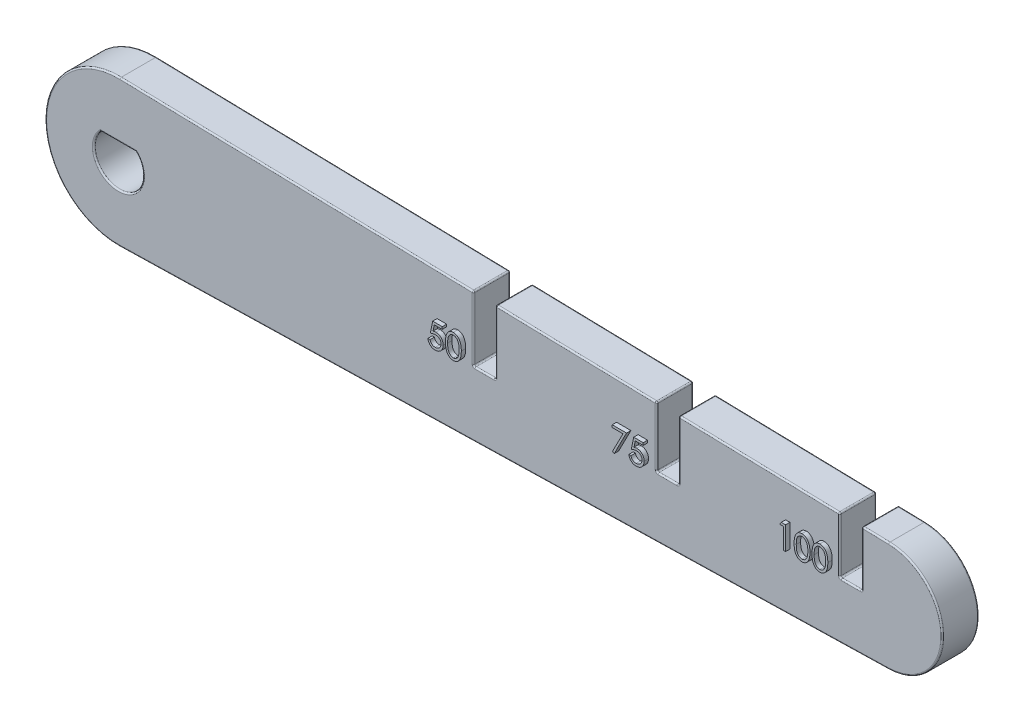
from build123d import *

# Parameters (mm, degrees)
BOSS_EXTRUDE1_DEPTH = 5
CUT_EXTRUDE2_REACH  = 115.054
CUT_EXTRUDE3_REACH  = 115.054
SKETCH4_W           = 3
SKETCH4_H           = 7.656932545
SKETCH4_H_2         = 8.25233943
SKETCH4_H_3         = 8.847746315
FILLET1_R           = 0.2
BOSS_EXTRUDE2_DEPTH = 0.6


with BuildPart() as part:
    # Sketch3 → Boss-Extrude1 (new body)
    with BuildSketch(Plane.XY):
        with BuildLine():
            Line((0.238095238, 9.997165131), (105.178571429, 7.497873848))
            ThreePointArc((105.178571429, 7.497873848), (112.5, 0), (105.178571429, -7.497873848))
            Line((105.178571429, -7.497873848), (0.238095238, -9.997165131))
            ThreePointArc((0.238095238, -9.997165131), (-10, 0), (0.238095238, 9.997165131))
        make_face()
    extrude(amount=BOSS_EXTRUDE1_DEPTH)

    # Sketch2 → Cut-Extrude2 (cut, up to next)
    with BuildSketch(Plane.XY, mode=Mode.PRIVATE) as cut_extrude2_sk1:
        with BuildLine():
            Line((-2.4, 2.337199179), (2.4, 2.337199179))
            ThreePointArc((2.4, 2.337199179), (0, -3.35), (-2.4, 2.337199179))
        make_face()
    cut_extrude2_tool1 = extrude(cut_extrude2_sk1.sketch, amount=CUT_EXTRUDE2_REACH, mode=Mode.PRIVATE) & part.part
    add(cut_extrude2_tool1.solids().sort_by_distance((0, -0.288877, 0))[0], mode=Mode.SUBTRACT)

    # Sketch4 → Cut-Extrude3 (cut, up to next)
    with BuildSketch(Plane.XY.offset(5), mode=Mode.PRIVATE) as cut_extrude3_sk1:
        with Locations((100, 3.828466273)):
            Rectangle(SKETCH4_W, SKETCH4_H)
    cut_extrude3_tool1 = extrude(cut_extrude3_sk1.sketch, amount=-CUT_EXTRUDE3_REACH, mode=Mode.PRIVATE) & part.part
    # Sketch4 → Cut-Extrude3 (cut, up to next)
    with BuildSketch(Plane.XY.offset(5), mode=Mode.PRIVATE) as cut_extrude3_sk2:
        with Locations((75, 4.126169715)):
            Rectangle(SKETCH4_W, SKETCH4_H_2)
    cut_extrude3_tool2 = extrude(cut_extrude3_sk2.sketch, amount=-CUT_EXTRUDE3_REACH, mode=Mode.PRIVATE) & part.part
    # Sketch4 → Cut-Extrude3 (cut, up to next)
    with BuildSketch(Plane.XY.offset(5), mode=Mode.PRIVATE) as cut_extrude3_sk3:
        with Locations((50, 4.423873158)):
            Rectangle(SKETCH4_W, SKETCH4_H_3)
    cut_extrude3_tool3 = extrude(cut_extrude3_sk3.sketch, amount=-CUT_EXTRUDE3_REACH, mode=Mode.PRIVATE) & part.part
    add(cut_extrude3_tool1.solids().sort_by_distance((100, 3.828466, 5))[0], mode=Mode.SUBTRACT)
    add(cut_extrude3_tool2.solids().sort_by_distance((75, 4.12617, 5))[0], mode=Mode.SUBTRACT)
    add(cut_extrude3_tool3.solids().sort_by_distance((50, 4.423873, 5))[0], mode=Mode.SUBTRACT)

    # Fillet1
    fillet1_edges = [part.edges().sort_by_distance(p)[0] for p in [
        (112.5, 0, 5),
        (0, -3.35, 0),
        (0, 2.337199179, 0),
        (0, 2.337199179, 5),
        (103.339285714, 7.541678783, 5),
        (0, -3.35, 5),
        (87.5, 7.918911574, 0),
        (62.5, 8.51431846, 0),
        (24.369047619, 9.422455723, 0),
        (87.5, 7.918911574, 5),
        (62.5, 8.51431846, 5),
        (24.369047619, 9.422455723, 5),
        (100, 0, 0),
        (98.5, 3.828466272, 0),
        (101.5, 3.792741859, 0),
        (98.5, 7.656932545, 2.5),
        (101.5, 7.585483719, 2.5),
        (98.5, 0, 2.5),
        (101.5, 0, 2.5),
        (98.5, 3.828466272, 5),
        (100, 0, 5),
        (101.5, 3.792741859, 5),
        (75, 0, 0),
        (73.5, 4.126169715, 0),
        (76.5, 4.090445302, 0),
        (73.5, 8.25233943, 2.5),
        (76.5, 8.180890604, 2.5),
        (73.5, 0, 2.5),
        (76.5, 0, 2.5),
        (73.5, 4.126169715, 5),
        (75, 0, 5),
        (76.5, 4.090445302, 5),
        (50, 0, 0),
        (48.5, 4.423873158, 0),
        (51.5, 4.388148745, 0),
        (48.5, 8.847746315, 2.5),
        (51.5, 8.776297489, 2.5),
        (48.5, 0, 2.5),
        (51.5, 0, 2.5),
        (48.5, 4.423873158, 5),
        (50, 0, 5),
        (51.5, 4.388148745, 5),
        (-10, 0, 5),
        (103.339285714, 7.541678783, 0),
        (112.5, 0, 0),
        (52.708333333, -8.74751949, 0),
        (-10, 0, 0),
        (52.708333333, -8.74751949, 5),
    ]]
    fillet(fillet1_edges, radius=FILLET1_R)

    # Sketch5 → Boss-Extrude2 (add)
    # profile 1 of 7: a face of its own
    with BuildSketch(Plane.XY.offset(5)):
        with BuildLine():
            Line((44.816666667, 3.175), (44.816666667, 2.849358974))
            Line((44.816666667, 2.849358974), (43.736708734, 2.849358974))
            Line((43.736708734, 2.849358974), (43.565619992, 2.014267829))
            add(Edge.make_bspline(
                [(43.565619992, 2.014267829), (43.599234964, 2.023548147), (43.664358655, 2.041527295), (43.760479386, 2.061489672), (43.851730885, 2.073523325), (43.910944971, 2.075166443), (43.939598357, 2.075961538)],
                knots=[0, 0, 0, 0, 1.100273476, 2.13160584, 3.095893838, 4, 4, 4, 4], degree=3))
            add(Edge.make_bspline(
                [(43.939598357, 2.075961538), (43.975052893, 2.075194154), (44.044765367, 2.073685284), (44.146763555, 2.059196535), (44.244129822, 2.036391041), (44.336660544, 2.004531711), (44.424526901, 1.963792167), (44.506920474, 1.912901507), (44.58507801, 1.853453414), (44.657597363, 1.785104724), (44.723387271, 1.709882972), (44.781232133, 1.629004046), (44.83036534, 1.543253952), (44.869881167, 1.4518134), (44.901435528, 1.355693311), (44.922437695, 1.253882325), (44.936422852, 1.147340102), (44.937985302, 1.074492385), (44.938782051, 1.037344752)],
                knots=[0, 0, 0, 0, 1.052922333, 2.070308379, 3.05430497, 4.020497103, 4.973039431, 5.925935799, 6.892292201, 7.88610001, 8.88166317, 9.857072816, 10.836096531, 11.812156883, 12.81219415, 13.836441305, 14.89672472, 16, 16, 16, 16], degree=3))
            add(Edge.make_bspline(
                [(44.938782051, 1.037344752), (44.938178733, 1.011471023), (44.93698025, 0.960073227), (44.930885531, 0.883742417), (44.919150989, 0.809027561), (44.903395982, 0.735918748), (44.882946788, 0.664554389), (44.858191718, 0.594730218), (44.82789675, 0.526880824), (44.79466686, 0.460364216), (44.757250412, 0.396684142), (44.715722766, 0.337131132), (44.671848356, 0.28081182), (44.624639385, 0.228330219), (44.573657054, 0.180031196), (44.519518798, 0.135628112), (44.462656617, 0.094370048), (44.40219079, 0.057931757), (44.339468681, 0.024401075), (44.273584512, -0.003106705), (44.20603802, -0.027699827), (44.135857025, -0.047302756), (44.063200495, -0.062663002), (43.987948663, -0.073095689), (43.910496198, -0.080694315), (43.857995294, -0.081169982), (43.831475361, -0.081410256)],
                knots=[0, 0, 0, 0, 1.056347294, 2.098418968, 3.122841568, 4.141288669, 5.149314143, 6.15115421, 7.162517403, 8.180376062, 9.185164535, 10.17417709, 11.141909838, 12.097768115, 13.052685741, 14.0056014, 14.954263652, 15.917497458, 16.885230207, 17.854509472, 18.828990115, 19.81800267, 20.826176721, 21.857883937, 22.917946725, 24, 24, 24, 24], degree=3))
            add(Edge.make_bspline(
                [(43.831475361, -0.081410256), (43.799839497, -0.080783568), (43.737599672, -0.079550632), (43.646413157, -0.066652434), (43.558679194, -0.048179453), (43.47510403, -0.02038798), (43.39493867, 0.014434781), (43.319262347, 0.058445879), (43.246141393, 0.10831978), (43.178548331, 0.167175529), (43.115813857, 0.231506183), (43.05965581, 0.301317758), (43.009641779, 0.375458038), (42.96657268, 0.454287077), (42.929835189, 0.537597745), (42.90097445, 0.625702181), (42.877680514, 0.718140042), (42.867825839, 0.781779298), (42.862820513, 0.814102564)],
                knots=[0, 0, 0, 0, 1.0467383, 2.05933395, 3.04377827, 4.011590433, 4.970194871, 5.932262533, 6.905835911, 7.896367577, 8.894135286, 9.877477877, 10.858688626, 11.851381753, 12.8477658, 13.868841284, 14.917554742, 16, 16, 16, 16], degree=3))
            Line((42.862820513, 0.814102564), (43.14775641, 0.814102564))
            add(Edge.make_bspline(
                [(43.14775641, 0.814102564), (43.154767316, 0.783825354), (43.168242666, 0.725630874), (43.197820738, 0.643868872), (43.233984782, 0.571007861), (43.276987298, 0.506084025), (43.328286254, 0.449470149), (43.386823665, 0.399017529), (43.452453385, 0.353501518), (43.525381529, 0.315562294), (43.602319108, 0.283205639), (43.682843649, 0.261659459), (43.764762592, 0.246509363), (43.820169399, 0.244992837), (43.848011819, 0.244230769)],
                knots=[0, 0, 0, 0, 1.136247022, 2.183929868, 3.172523383, 4.106158343, 5.02341133, 5.958108904, 6.928429099, 7.938127109, 8.96079061, 9.975095812, 10.982467395, 12, 12, 12, 12], degree=3))
            add(Edge.make_bspline(
                [(43.848011819, 0.244230769), (43.875188408, 0.244975332), (43.928699334, 0.246441382), (44.007449663, 0.257725343), (44.083479913, 0.275103997), (44.156039872, 0.301111651), (44.226399269, 0.332720789), (44.292778332, 0.37328375), (44.357097371, 0.419965339), (44.417357178, 0.473447424), (44.472547249, 0.532384219), (44.521311731, 0.59541014), (44.561930788, 0.662644708), (44.596161015, 0.732923925), (44.622153651, 0.807018045), (44.640696541, 0.884579825), (44.65158503, 0.965800843), (44.653082886, 1.021199431), (44.653846154, 1.049429087)],
                knots=[0, 0, 0, 0, 1.027316725, 2.022795036, 3.002884548, 3.971462791, 4.93288096, 5.914575861, 6.907176829, 7.935150275, 8.956128384, 9.956726525, 10.942570165, 11.921478529, 12.907843606, 13.90538589, 14.932640048, 16, 16, 16, 16], degree=3))
            add(Edge.make_bspline(
                [(44.653846154, 1.049429087), (44.653248819, 1.074897804), (44.652079621, 1.124749195), (44.642526889, 1.197682761), (44.625910778, 1.266691878), (44.602847687, 1.33210979), (44.573565563, 1.393998198), (44.537782122, 1.452420974), (44.494825825, 1.506608094), (44.445756755, 1.556584911), (44.392001246, 1.602708476), (44.332634423, 1.642027754), (44.268898632, 1.675105737), (44.201561781, 1.703651707), (44.129022195, 1.724153812), (44.052716392, 1.739546108), (43.971820379, 1.748450044), (43.916511254, 1.749685471), (43.888080929, 1.750320513)],
                knots=[0, 0, 0, 0, 1.045622112, 2.046656509, 3.013763289, 3.955457236, 4.890082067, 5.820317437, 6.762574623, 7.722996705, 8.69280354, 9.665887285, 10.63943826, 11.638615906, 12.663482002, 13.728887084, 14.832589034, 16, 16, 16, 16], degree=3))
            add(Edge.make_bspline(
                [(43.888080929, 1.750320513), (43.863471115, 1.749793834), (43.812658093, 1.748706375), (43.734713815, 1.740699481), (43.652806323, 1.727782407), (43.567249602, 1.710014883), (43.477786713, 1.686763834), (43.384606449, 1.658901395), (43.287512893, 1.625589296), (43.222091814, 1.600432216), (43.188461538, 1.5875)],
                knots=[0, 0, 0, 0, 0.817624296, 1.688186739, 2.600797293, 3.572016777, 4.590301741, 5.671205678, 6.80286297, 8, 8, 8, 8], degree=3))
            Line((43.188461538, 1.5875), (43.514102564, 3.175))
            Line((43.514102564, 3.175), (44.816666667, 3.175))
        make_face()
    # profile 2 of 7: a face of its own
    with BuildSketch(Plane.XY.offset(5)):
        with BuildLine():
            add(Edge.make_bspline(
                [(45.264423077, 1.586227965), (45.264720636, 1.637116309), (45.26529865, 1.735967652), (45.27172886, 1.880008006), (45.282410778, 2.015136268), (45.29704968, 2.141358907), (45.314864134, 2.258708507), (45.338645325, 2.366871466), (45.365689796, 2.466348394), (45.3970338, 2.557463681), (45.432401295, 2.641444883), (45.470895231, 2.719844887), (45.514043295, 2.792545069), (45.559379494, 2.860705779), (45.608739016, 2.923211273), (45.660717205, 2.98094426), (45.717342764, 3.032570441), (45.776690779, 3.079602444), (45.839298571, 3.120831607), (45.903381561, 3.15714702), (45.969380836, 3.188171185), (46.037476588, 3.212564652), (46.107056765, 3.232713063), (46.178364604, 3.246491609), (46.251517842, 3.25516109), (46.300894929, 3.255989917), (46.325936498, 3.256410256)],
                knots=[0, 0, 0, 0, 1.646270934, 3.197905019, 4.663502075, 6.030701355, 7.308322542, 8.50163776, 9.611534131, 10.641858119, 11.616356847, 12.558055219, 13.465016945, 14.349605745, 15.204443733, 16.039544428, 16.859896111, 17.680448484, 18.487036065, 19.28249412, 20.06191084, 20.843045899, 21.620316918, 22.403196591, 23.190181807, 24, 24, 24, 24], degree=3))
            add(Edge.make_bspline(
                [(46.325936498, 3.256410256), (46.351187254, 3.255967738), (46.401403062, 3.255087709), (46.475643974, 3.246629561), (46.548169756, 3.232595043), (46.618671211, 3.212709587), (46.687727449, 3.188039223), (46.754798333, 3.157117338), (46.820300471, 3.121122937), (46.883192946, 3.07882842), (46.944166204, 3.031673069), (47.001722571, 2.978366934), (47.055867284, 2.91944826), (47.107279883, 2.855547427), (47.154501746, 2.785438814), (47.199471931, 2.7103418), (47.239723706, 2.628943087), (47.278490162, 2.542600805), (47.311951928, 2.448925915), (47.342129165, 2.348446454), (47.366512229, 2.239975584), (47.386822498, 2.124082419), (47.402556796, 2.000341345), (47.414016407, 1.869017616), (47.420069849, 1.730024833), (47.421209856, 1.634994498), (47.421794872, 1.586227965)],
                knots=[0, 0, 0, 0, 0.810914788, 1.612654377, 2.396697861, 3.181598691, 3.963628158, 4.749916497, 5.551656086, 6.361998678, 7.18212741, 8.025565596, 8.878627764, 9.750805457, 10.657531673, 11.591944965, 12.560506719, 13.57287815, 14.630710178, 15.753379473, 16.941251878, 18.199788006, 19.531962791, 20.947069417, 22.433333509, 24, 24, 24, 24], degree=3))
            add(Edge.make_bspline(
                [(47.421794872, 1.586227965), (47.421203792, 1.537674134), (47.420052096, 1.443068975), (47.414084269, 1.30470159), (47.402328939, 1.174074794), (47.387624164, 1.050875303), (47.367257933, 0.935615891), (47.342216104, 0.827897713), (47.314411883, 0.727255591), (47.280090319, 0.634514012), (47.242524889, 0.548379235), (47.20165339, 0.467945464), (47.157865762, 0.392501756), (47.110160258, 0.322651986), (47.059311804, 0.257901347), (47.004232096, 0.199392789), (46.946473779, 0.145716537), (46.885321088, 0.097953989), (46.821447752, 0.056148487), (46.756170589, 0.018761637), (46.688331377, -0.011385165), (46.619467484, -0.037270523), (46.548593895, -0.057046647), (46.475798955, -0.070720788), (46.401452941, -0.080310965), (46.351195807, -0.081042557), (46.325936498, -0.081410256)],
                knots=[0, 0, 0, 0, 1.561518951, 3.042555995, 4.452378317, 5.7783523, 7.031515105, 8.214008947, 9.334062868, 10.386615937, 11.391082383, 12.354592575, 13.286541444, 14.194233754, 15.072674879, 15.931287219, 16.775624067, 17.606195743, 18.42308326, 19.229000347, 20.022332153, 20.807536673, 21.593273796, 22.3848459, 23.188221202, 24, 24, 24, 24], degree=3))
            add(Edge.make_bspline(
                [(46.325936498, -0.081410256), (46.300895624, -0.080987205), (46.251519906, -0.080153031), (46.178356634, -0.071522718), (46.107343275, -0.057647511), (46.038129405, -0.038219592), (45.970359924, -0.01443899), (45.904958292, 0.01654328), (45.841197322, 0.052224899), (45.779247125, 0.092860746), (45.720271807, 0.139416844), (45.663939501, 0.190910163), (45.611665377, 0.248625686), (45.56301159, 0.311652088), (45.51677081, 0.379409529), (45.47423545, 0.452823125), (45.434891889, 0.531601779), (45.39892958, 0.616254455), (45.367044721, 0.708016425), (45.338880014, 0.807937466), (45.316642171, 0.916899507), (45.297607633, 1.034027404), (45.2822548, 1.15982447), (45.271773376, 1.294358997), (45.265295184, 1.437547151), (45.264719084, 1.535763303), (45.264423077, 1.586227965)],
                knots=[0, 0, 0, 0, 0.810891512, 1.598919785, 2.382837074, 3.152667961, 3.926044502, 4.706494248, 5.493654104, 6.291793342, 7.103789334, 7.925228297, 8.761435821, 9.622817696, 10.50288917, 11.416980706, 12.369136599, 13.353924996, 14.394355917, 15.514179734, 16.714354668, 17.994756427, 19.357759367, 20.818452758, 22.365282078, 24, 24, 24, 24], degree=3))
        make_face()
        with BuildLine():
            add(Edge.make_bspline(
                [(45.549358974, 1.5875), (45.54946733, 1.545092252), (45.549677627, 1.46278714), (45.555171466, 1.343186467), (45.562655605, 1.231634812), (45.572308782, 1.127990532), (45.586644313, 1.03260445), (45.6027069, 0.944820523), (45.622254095, 0.865103315), (45.645381719, 0.792905801), (45.671724328, 0.727002717), (45.700486076, 0.665678758), (45.731384017, 0.608209501), (45.765963532, 0.555111156), (45.803623625, 0.506210565), (45.843513653, 0.46064221), (45.887122355, 0.420004948), (45.94745075, 0.371267015), (46.027094694, 0.32090323), (46.12744325, 0.27704642), (46.230556774, 0.249485191), (46.300543979, 0.245980213), (46.335476763, 0.244230769)],
                knots=[0, 0, 0, 0, 1.459021318, 2.831673884, 4.118529203, 5.306027144, 6.411944654, 7.436330062, 8.375795394, 9.233974572, 10.042671642, 10.816086306, 11.563610507, 12.285937304, 12.993564865, 13.685989202, 14.367179055, 15.041617293, 16.353048772, 17.594441528, 18.799311195, 20, 20, 20, 20], degree=3))
            add(Edge.make_bspline(
                [(46.335476763, 0.244230769), (46.370635508, 0.245680185), (46.440880408, 0.248576023), (46.543508922, 0.276514878), (46.643140667, 0.318669388), (46.721220213, 0.368514626), (46.780622235, 0.415983896), (46.823182647, 0.456455755), (46.862246077, 0.501772864), (46.899295673, 0.550667225), (46.933276406, 0.604072978), (46.964176538, 0.661733315), (46.992373575, 0.723808354), (47.00843821, 0.767142332), (47.016651643, 0.789297877)],
                knots=[0, 0, 0, 0, 1.353760809, 2.704726607, 4.075137775, 5.516104923, 6.260822281, 7.007110065, 7.778089737, 8.566572457, 9.372053459, 10.217411131, 11.088608312, 12, 12, 12, 12], degree=3))
            add(Edge.make_bspline(
                [(47.016651643, 0.789297877), (47.026223603, 0.817627712), (47.045658789, 0.875149426), (47.070706613, 0.964379311), (47.090432796, 1.057998961), (47.108179564, 1.155448888), (47.120292693, 1.25744776), (47.130042495, 1.36367998), (47.135785332, 1.474225644), (47.136497214, 1.549332529), (47.136858974, 1.5875)],
                knots=[0, 0, 0, 0, 0.884706709, 1.796334032, 2.740027952, 3.714592787, 4.726048262, 5.777819803, 6.87074269, 8, 8, 8, 8], degree=3))
            add(Edge.make_bspline(
                [(47.136858974, 1.5875), (47.136359874, 1.625661298), (47.135383527, 1.700312955), (47.131651553, 1.809640161), (47.122014453, 1.913478773), (47.111310967, 2.01227613), (47.095529202, 2.105485333), (47.078513191, 2.193886682), (47.055652092, 2.276384997), (47.03123201, 2.354271903), (47.00328258, 2.426662497), (46.972516164, 2.493894289), (46.939657854, 2.556291861), (46.903968822, 2.613684015), (46.865872738, 2.666327822), (46.824364104, 2.713167775), (46.781089423, 2.755655596), (46.72047669, 2.804153784), (46.641125013, 2.853603679), (46.542386461, 2.89911119), (46.439633805, 2.925244427), (46.370170743, 2.928928957), (46.335476763, 2.930769231)],
                knots=[0, 0, 0, 0, 1.31362396, 2.569729283, 3.763502607, 4.902122613, 5.988968491, 7.01645872, 7.998833611, 8.933434873, 9.825090667, 10.667526885, 11.477055099, 12.250526234, 12.991942729, 13.710640831, 14.402115721, 15.076753259, 16.378508321, 17.609869233, 18.806226677, 20, 20, 20, 20], degree=3))
            add(Edge.make_bspline(
                [(46.335476763, 2.930769231), (46.300360726, 2.928926418), (46.230064678, 2.925237437), (46.126244034, 2.899208557), (46.026726515, 2.853839652), (45.947584674, 2.80399), (45.886929667, 2.756511674), (45.844218938, 2.715339677), (45.804172053, 2.670303432), (45.76728064, 2.620953123), (45.732728219, 2.567916683), (45.700995443, 2.510776875), (45.672404722, 2.449244137), (45.646020893, 2.383370657), (45.622822721, 2.311179371), (45.603687483, 2.231560356), (45.586009942, 2.144055639), (45.573495662, 2.048152943), (45.562370684, 1.944482704), (45.555221175, 1.832652565), (45.549659249, 1.712851306), (45.549461071, 1.630120641), (45.549358974, 1.5875)],
                knots=[0, 0, 0, 0, 1.207732386, 2.417664972, 3.655092373, 4.956220595, 5.625982001, 6.301752483, 6.994047911, 7.697131622, 8.419323945, 9.170223765, 9.943494443, 10.752040957, 11.610060368, 12.549350801, 13.567764191, 14.679664412, 15.874934091, 17.154273443, 18.533957287, 20, 20, 20, 20], degree=3))
        make_face(mode=Mode.SUBTRACT)
    # profile 3 of 7: a face of its own
    with BuildSketch(Plane.XY.offset(5)):
        Polygon((68.025641026, 3.175), (69.979487179, 3.175), (68.310576923, -0.081410256), (68.064438101, 0.054061498), (69.497385817, 2.849358974), (68.025641026, 2.849358974), align=None)
    # profile 4 of 7: a face of its own
    with BuildSketch(Plane.XY.offset(5)):
        with BuildLine():
            Line((72.258974359, 3.175), (72.258974359, 2.849358974))
            Line((72.258974359, 2.849358974), (71.179016426, 2.849358974))
            Line((71.179016426, 2.849358974), (71.007927684, 2.014267829))
            add(Edge.make_bspline(
                [(71.007927684, 2.014267829), (71.041542656, 2.023548147), (71.106666347, 2.041527295), (71.202787078, 2.061489672), (71.294038577, 2.073523325), (71.353252663, 2.075166443), (71.38190605, 2.075961538)],
                knots=[0, 0, 0, 0, 1.100273476, 2.13160584, 3.095893838, 4, 4, 4, 4], degree=3))
            add(Edge.make_bspline(
                [(71.38190605, 2.075961538), (71.417360585, 2.075194154), (71.48707306, 2.073685284), (71.589071247, 2.059196535), (71.686437515, 2.036391041), (71.778968236, 2.004531711), (71.866834593, 1.963792167), (71.949228167, 1.912901507), (72.027385702, 1.853453414), (72.099905055, 1.785104724), (72.165694963, 1.709882972), (72.223539825, 1.629004046), (72.272673032, 1.543253952), (72.31218886, 1.4518134), (72.34374322, 1.355693311), (72.364745387, 1.253882325), (72.378730544, 1.147340102), (72.380292995, 1.074492385), (72.381089744, 1.037344752)],
                knots=[0, 0, 0, 0, 1.052922333, 2.070308379, 3.05430497, 4.020497103, 4.973039431, 5.925935799, 6.892292201, 7.88610001, 8.88166317, 9.857072816, 10.836096531, 11.812156883, 12.81219415, 13.836441305, 14.89672472, 16, 16, 16, 16], degree=3))
            add(Edge.make_bspline(
                [(72.381089744, 1.037344752), (72.380486425, 1.011471023), (72.379287942, 0.960073227), (72.373193223, 0.883742417), (72.361458681, 0.809027561), (72.345703674, 0.735918748), (72.325254481, 0.664554389), (72.30049941, 0.594730218), (72.270204442, 0.526880824), (72.236974552, 0.460364216), (72.199558104, 0.396684142), (72.158030458, 0.337131132), (72.114156048, 0.28081182), (72.066947077, 0.228330219), (72.015964746, 0.180031196), (71.96182649, 0.135628112), (71.904964309, 0.094370048), (71.844498482, 0.057931757), (71.781776373, 0.024401075), (71.715892204, -0.003106705), (71.648345712, -0.027699827), (71.578164718, -0.047302756), (71.505508188, -0.062663002), (71.430256356, -0.073095689), (71.352803891, -0.080694315), (71.300302986, -0.081169982), (71.273783053, -0.081410256)],
                knots=[0, 0, 0, 0, 1.056347294, 2.098418968, 3.122841568, 4.141288669, 5.149314143, 6.15115421, 7.162517403, 8.180376062, 9.185164535, 10.17417709, 11.141909838, 12.097768115, 13.052685741, 14.0056014, 14.954263652, 15.917497458, 16.885230207, 17.854509472, 18.828990115, 19.81800267, 20.826176721, 21.857883937, 22.917946725, 24, 24, 24, 24], degree=3))
            add(Edge.make_bspline(
                [(71.273783053, -0.081410256), (71.242147189, -0.080783568), (71.179907364, -0.079550632), (71.08872085, -0.066652434), (71.000986886, -0.048179453), (70.917411723, -0.02038798), (70.837246362, 0.014434781), (70.761570039, 0.058445879), (70.688449085, 0.10831978), (70.620856024, 0.167175529), (70.558121549, 0.231506183), (70.501963502, 0.301317758), (70.451949471, 0.375458038), (70.408880372, 0.454287077), (70.372142882, 0.537597745), (70.343282142, 0.625702181), (70.319988206, 0.718140042), (70.310133532, 0.781779298), (70.305128205, 0.814102564)],
                knots=[0, 0, 0, 0, 1.0467383, 2.05933395, 3.04377827, 4.011590433, 4.970194871, 5.932262533, 6.905835911, 7.896367577, 8.894135286, 9.877477877, 10.858688626, 11.851381753, 12.8477658, 13.868841284, 14.917554742, 16, 16, 16, 16], degree=3))
            Line((70.305128205, 0.814102564), (70.590064103, 0.814102564))
            add(Edge.make_bspline(
                [(70.590064103, 0.814102564), (70.597075008, 0.783825354), (70.610550358, 0.725630874), (70.64012843, 0.643868872), (70.676292474, 0.571007861), (70.71929499, 0.506084025), (70.770593947, 0.449470149), (70.829131357, 0.399017529), (70.894761078, 0.353501518), (70.967689221, 0.315562294), (71.044626801, 0.283205639), (71.125151341, 0.261659459), (71.207070284, 0.246509363), (71.262477091, 0.244992837), (71.290319511, 0.244230769)],
                knots=[0, 0, 0, 0, 1.136247022, 2.183929868, 3.172523383, 4.106158343, 5.02341133, 5.958108904, 6.928429099, 7.938127109, 8.96079061, 9.975095812, 10.982467395, 12, 12, 12, 12], degree=3))
            add(Edge.make_bspline(
                [(71.290319511, 0.244230769), (71.3174961, 0.244975332), (71.371007026, 0.246441382), (71.449757355, 0.257725343), (71.525787605, 0.275103997), (71.598347565, 0.301111651), (71.668706961, 0.332720789), (71.735086025, 0.37328375), (71.799405063, 0.419965339), (71.85966487, 0.473447424), (71.914854942, 0.532384219), (71.963619423, 0.59541014), (72.00423848, 0.662644708), (72.038468708, 0.732923925), (72.064461343, 0.807018045), (72.083004233, 0.884579825), (72.093892722, 0.965800843), (72.095390578, 1.021199431), (72.096153846, 1.049429087)],
                knots=[0, 0, 0, 0, 1.027316725, 2.022795036, 3.002884548, 3.971462791, 4.93288096, 5.914575861, 6.907176829, 7.935150275, 8.956128384, 9.956726525, 10.942570165, 11.921478529, 12.907843606, 13.90538589, 14.932640048, 16, 16, 16, 16], degree=3))
            add(Edge.make_bspline(
                [(72.096153846, 1.049429087), (72.095556511, 1.074897804), (72.094387313, 1.124749195), (72.084834581, 1.197682761), (72.068218471, 1.266691878), (72.04515538, 1.33210979), (72.015873255, 1.393998198), (71.980089814, 1.452420974), (71.937133518, 1.506608094), (71.888064447, 1.556584911), (71.834308939, 1.602708476), (71.774942115, 1.642027754), (71.711206324, 1.675105737), (71.643869473, 1.703651707), (71.571329887, 1.724153812), (71.495024085, 1.739546108), (71.414128071, 1.748450044), (71.358818947, 1.749685471), (71.330388622, 1.750320513)],
                knots=[0, 0, 0, 0, 1.045622112, 2.046656509, 3.013763289, 3.955457236, 4.890082067, 5.820317437, 6.762574623, 7.722996705, 8.69280354, 9.665887285, 10.63943826, 11.638615906, 12.663482002, 13.728887084, 14.832589034, 16, 16, 16, 16], degree=3))
            add(Edge.make_bspline(
                [(71.330388622, 1.750320513), (71.305778808, 1.749793834), (71.254965785, 1.748706375), (71.177021507, 1.740699481), (71.095114015, 1.727782407), (71.009557294, 1.710014883), (70.920094405, 1.686763834), (70.826914141, 1.658901395), (70.729820585, 1.625589296), (70.664399507, 1.600432216), (70.630769231, 1.5875)],
                knots=[0, 0, 0, 0, 0.817624296, 1.688186739, 2.600797293, 3.572016777, 4.590301741, 5.671205678, 6.80286297, 8, 8, 8, 8], degree=3))
            Line((70.630769231, 1.5875), (70.956410256, 3.175))
            Line((70.956410256, 3.175), (72.258974359, 3.175))
        make_face()
    # profile 5 of 7: a face of its own
    with BuildSketch(Plane.XY.offset(5)):
        Polygon((91.096930088, 3.175), (91.683974359, 3.175), (91.683974359, 0), (91.399038462, 0), (91.399038462, 2.849358974), (90.910576923, 2.849358974), align=None)
    # profile 6 of 7: a face of its own
    with BuildSketch(Plane.XY.offset(5)):
        with BuildLine():
            add(Edge.make_bspline(
                [(92.864423077, 1.586227965), (92.864720636, 1.637116309), (92.86529865, 1.735967652), (92.87172886, 1.880008006), (92.882410778, 2.015136268), (92.89704968, 2.141358907), (92.914864134, 2.258708507), (92.938645325, 2.366871466), (92.965689796, 2.466348394), (92.9970338, 2.557463681), (93.032401295, 2.641444883), (93.070895231, 2.719844887), (93.114043295, 2.792545069), (93.159379494, 2.860705779), (93.208739016, 2.923211273), (93.260717205, 2.98094426), (93.317342764, 3.032570441), (93.376690779, 3.079602444), (93.439298571, 3.120831607), (93.503381561, 3.15714702), (93.569380836, 3.188171185), (93.637476588, 3.212564652), (93.707056765, 3.232713063), (93.778364604, 3.246491609), (93.851517842, 3.25516109), (93.900894929, 3.255989917), (93.925936498, 3.256410256)],
                knots=[0, 0, 0, 0, 1.646270934, 3.197905019, 4.663502075, 6.030701355, 7.308322542, 8.50163776, 9.611534131, 10.641858119, 11.616356847, 12.558055219, 13.465016945, 14.349605745, 15.204443733, 16.039544428, 16.859896111, 17.680448484, 18.487036065, 19.28249412, 20.06191084, 20.843045899, 21.620316918, 22.403196591, 23.190181807, 24, 24, 24, 24], degree=3))
            add(Edge.make_bspline(
                [(93.925936498, 3.256410256), (93.951187254, 3.255967738), (94.001403062, 3.255087709), (94.075643974, 3.246629561), (94.148169756, 3.232595043), (94.218671211, 3.212709587), (94.287727449, 3.188039223), (94.354798333, 3.157117338), (94.420300471, 3.121122937), (94.483192946, 3.07882842), (94.544166204, 3.031673069), (94.601722571, 2.978366934), (94.655867284, 2.91944826), (94.707279883, 2.855547427), (94.754501746, 2.785438814), (94.799471931, 2.7103418), (94.839723706, 2.628943087), (94.878490162, 2.542600805), (94.911951928, 2.448925915), (94.942129165, 2.348446454), (94.966512229, 2.239975584), (94.986822498, 2.124082419), (95.002556796, 2.000341345), (95.014016407, 1.869017616), (95.020069849, 1.730024833), (95.021209856, 1.634994498), (95.021794872, 1.586227965)],
                knots=[0, 0, 0, 0, 0.810914788, 1.612654377, 2.396697861, 3.181598691, 3.963628158, 4.749916497, 5.551656086, 6.361998678, 7.18212741, 8.025565596, 8.878627764, 9.750805457, 10.657531673, 11.591944965, 12.560506719, 13.57287815, 14.630710178, 15.753379473, 16.941251878, 18.199788006, 19.531962791, 20.947069417, 22.433333509, 24, 24, 24, 24], degree=3))
            add(Edge.make_bspline(
                [(95.021794872, 1.586227965), (95.021203792, 1.537674134), (95.020052096, 1.443068975), (95.014084269, 1.30470159), (95.002328939, 1.174074794), (94.987624164, 1.050875303), (94.967257933, 0.935615891), (94.942216104, 0.827897713), (94.914411883, 0.727255591), (94.880090319, 0.634514012), (94.842524889, 0.548379235), (94.80165339, 0.467945464), (94.757865762, 0.392501756), (94.710160258, 0.322651986), (94.659311804, 0.257901347), (94.604232096, 0.199392789), (94.546473779, 0.145716537), (94.485321088, 0.097953989), (94.421447752, 0.056148487), (94.356170589, 0.018761637), (94.288331377, -0.011385165), (94.219467484, -0.037270523), (94.148593895, -0.057046647), (94.075798955, -0.070720788), (94.001452941, -0.080310965), (93.951195807, -0.081042557), (93.925936498, -0.081410256)],
                knots=[0, 0, 0, 0, 1.561518951, 3.042555995, 4.452378317, 5.7783523, 7.031515105, 8.214008947, 9.334062868, 10.386615937, 11.391082383, 12.354592575, 13.286541444, 14.194233754, 15.072674879, 15.931287219, 16.775624067, 17.606195743, 18.42308326, 19.229000347, 20.022332153, 20.807536673, 21.593273796, 22.3848459, 23.188221202, 24, 24, 24, 24], degree=3))
            add(Edge.make_bspline(
                [(93.925936498, -0.081410256), (93.900895624, -0.080987205), (93.851519906, -0.080153031), (93.778356634, -0.071522718), (93.707343275, -0.057647511), (93.638129405, -0.038219592), (93.570359924, -0.01443899), (93.504958292, 0.01654328), (93.441197322, 0.052224899), (93.379247125, 0.092860746), (93.320271807, 0.139416844), (93.263939501, 0.190910163), (93.211665377, 0.248625686), (93.16301159, 0.311652088), (93.11677081, 0.379409529), (93.07423545, 0.452823125), (93.034891889, 0.531601779), (92.99892958, 0.616254455), (92.967044721, 0.708016425), (92.938880014, 0.807937466), (92.916642171, 0.916899507), (92.897607633, 1.034027404), (92.8822548, 1.15982447), (92.871773376, 1.294358997), (92.865295184, 1.437547151), (92.864719084, 1.535763303), (92.864423077, 1.586227965)],
                knots=[0, 0, 0, 0, 0.810891512, 1.598919785, 2.382837074, 3.152667961, 3.926044502, 4.706494248, 5.493654104, 6.291793342, 7.103789334, 7.925228297, 8.761435821, 9.622817696, 10.50288917, 11.416980706, 12.369136599, 13.353924996, 14.394355917, 15.514179734, 16.714354668, 17.994756427, 19.357759367, 20.818452758, 22.365282078, 24, 24, 24, 24], degree=3))
        make_face()
        with BuildLine():
            add(Edge.make_bspline(
                [(93.149358974, 1.5875), (93.14946733, 1.545092252), (93.149677627, 1.46278714), (93.155171466, 1.343186467), (93.162655605, 1.231634812), (93.172308782, 1.127990532), (93.186644313, 1.03260445), (93.2027069, 0.944820523), (93.222254095, 0.865103315), (93.245381719, 0.792905801), (93.271724328, 0.727002717), (93.300486076, 0.665678758), (93.331384017, 0.608209501), (93.365963532, 0.555111156), (93.403623625, 0.506210565), (93.443513653, 0.46064221), (93.487122355, 0.420004948), (93.54745075, 0.371267015), (93.627094694, 0.32090323), (93.72744325, 0.27704642), (93.830556774, 0.249485191), (93.900543979, 0.245980213), (93.935476763, 0.244230769)],
                knots=[0, 0, 0, 0, 1.459021318, 2.831673884, 4.118529203, 5.306027144, 6.411944654, 7.436330062, 8.375795394, 9.233974572, 10.042671642, 10.816086306, 11.563610507, 12.285937304, 12.993564865, 13.685989202, 14.367179055, 15.041617293, 16.353048772, 17.594441528, 18.799311195, 20, 20, 20, 20], degree=3))
            add(Edge.make_bspline(
                [(93.935476763, 0.244230769), (93.970635508, 0.245680185), (94.040880408, 0.248576023), (94.143508922, 0.276514878), (94.243140667, 0.318669388), (94.321220213, 0.368514626), (94.380622235, 0.415983896), (94.423182647, 0.456455755), (94.462246077, 0.501772864), (94.499295673, 0.550667225), (94.533276406, 0.604072978), (94.564176538, 0.661733315), (94.592373575, 0.723808354), (94.60843821, 0.767142332), (94.616651643, 0.789297877)],
                knots=[0, 0, 0, 0, 1.353760809, 2.704726607, 4.075137775, 5.516104923, 6.260822281, 7.007110065, 7.778089737, 8.566572457, 9.372053459, 10.217411131, 11.088608312, 12, 12, 12, 12], degree=3))
            add(Edge.make_bspline(
                [(94.616651643, 0.789297877), (94.626223603, 0.817627712), (94.645658789, 0.875149426), (94.670706613, 0.964379311), (94.690432796, 1.057998961), (94.708179564, 1.155448888), (94.720292693, 1.25744776), (94.730042495, 1.36367998), (94.735785332, 1.474225644), (94.736497214, 1.549332529), (94.736858974, 1.5875)],
                knots=[0, 0, 0, 0, 0.884706709, 1.796334032, 2.740027952, 3.714592787, 4.726048262, 5.777819803, 6.87074269, 8, 8, 8, 8], degree=3))
            add(Edge.make_bspline(
                [(94.736858974, 1.5875), (94.736359874, 1.625661298), (94.735383527, 1.700312955), (94.731651553, 1.809640161), (94.722014453, 1.913478773), (94.711310967, 2.01227613), (94.695529202, 2.105485333), (94.678513191, 2.193886682), (94.655652092, 2.276384997), (94.63123201, 2.354271903), (94.60328258, 2.426662497), (94.572516164, 2.493894289), (94.539657854, 2.556291861), (94.503968822, 2.613684015), (94.465872738, 2.666327822), (94.424364104, 2.713167775), (94.381089423, 2.755655596), (94.32047669, 2.804153784), (94.241125013, 2.853603679), (94.142386461, 2.89911119), (94.039633805, 2.925244427), (93.970170743, 2.928928957), (93.935476763, 2.930769231)],
                knots=[0, 0, 0, 0, 1.31362396, 2.569729283, 3.763502607, 4.902122613, 5.988968491, 7.01645872, 7.998833611, 8.933434873, 9.825090667, 10.667526885, 11.477055099, 12.250526234, 12.991942729, 13.710640831, 14.402115721, 15.076753259, 16.378508321, 17.609869233, 18.806226677, 20, 20, 20, 20], degree=3))
            add(Edge.make_bspline(
                [(93.935476763, 2.930769231), (93.900360726, 2.928926418), (93.830064678, 2.925237437), (93.726244034, 2.899208557), (93.626726515, 2.853839652), (93.547584674, 2.80399), (93.486929667, 2.756511674), (93.444218938, 2.715339677), (93.404172053, 2.670303432), (93.36728064, 2.620953123), (93.332728219, 2.567916683), (93.300995443, 2.510776875), (93.272404722, 2.449244137), (93.246020893, 2.383370657), (93.222822721, 2.311179371), (93.203687483, 2.231560356), (93.186009942, 2.144055639), (93.173495662, 2.048152943), (93.162370684, 1.944482704), (93.155221175, 1.832652565), (93.149659249, 1.712851306), (93.149461071, 1.630120641), (93.149358974, 1.5875)],
                knots=[0, 0, 0, 0, 1.207732386, 2.417664972, 3.655092373, 4.956220595, 5.625982001, 6.301752483, 6.994047911, 7.697131622, 8.419323945, 9.170223765, 9.943494443, 10.752040957, 11.610060368, 12.549350801, 13.567764191, 14.679664412, 15.874934091, 17.154273443, 18.533957287, 20, 20, 20, 20], degree=3))
        make_face(mode=Mode.SUBTRACT)
    # profile 7 of 7: a face of its own
    with BuildSketch(Plane.XY.offset(5)):
        with BuildLine():
            add(Edge.make_bspline(
                [(95.306730769, 1.586227965), (95.307028329, 1.637116309), (95.307606342, 1.735967652), (95.314036552, 1.880008006), (95.32471847, 2.015136268), (95.339357372, 2.141358907), (95.357171826, 2.258708507), (95.380953017, 2.366871466), (95.407997488, 2.466348394), (95.439341493, 2.557463681), (95.474708987, 2.641444883), (95.513202924, 2.719844887), (95.556350987, 2.792545069), (95.601687187, 2.860705779), (95.651046709, 2.923211273), (95.703024897, 2.98094426), (95.759650456, 3.032570441), (95.818998471, 3.079602444), (95.881606264, 3.120831607), (95.945689254, 3.15714702), (96.011688528, 3.188171185), (96.07978428, 3.212564652), (96.149364458, 3.232713063), (96.220672297, 3.246491609), (96.293825534, 3.25516109), (96.343202621, 3.255989917), (96.368244191, 3.256410256)],
                knots=[0, 0, 0, 0, 1.646270934, 3.197905019, 4.663502075, 6.030701355, 7.308322542, 8.50163776, 9.611534131, 10.641858119, 11.616356847, 12.558055219, 13.465016945, 14.349605745, 15.204443733, 16.039544428, 16.859896111, 17.680448484, 18.487036065, 19.28249412, 20.06191084, 20.843045899, 21.620316918, 22.403196591, 23.190181807, 24, 24, 24, 24], degree=3))
            add(Edge.make_bspline(
                [(96.368244191, 3.256410256), (96.393494946, 3.255967738), (96.443710754, 3.255087709), (96.517951666, 3.246629561), (96.590477449, 3.232595043), (96.660978903, 3.212709587), (96.730035141, 3.188039223), (96.797106025, 3.157117338), (96.862608163, 3.121122937), (96.925500638, 3.07882842), (96.986473897, 3.031673069), (97.044030263, 2.978366934), (97.098174977, 2.91944826), (97.149587575, 2.855547427), (97.196809438, 2.785438814), (97.241779623, 2.7103418), (97.282031399, 2.628943087), (97.320797854, 2.542600805), (97.354259621, 2.448925915), (97.384436857, 2.348446454), (97.408819922, 2.239975584), (97.42913019, 2.124082419), (97.444864489, 2.000341345), (97.4563241, 1.869017616), (97.462377541, 1.730024833), (97.463517549, 1.634994498), (97.464102564, 1.586227965)],
                knots=[0, 0, 0, 0, 0.810914788, 1.612654377, 2.396697861, 3.181598691, 3.963628158, 4.749916497, 5.551656086, 6.361998678, 7.18212741, 8.025565596, 8.878627764, 9.750805457, 10.657531673, 11.591944965, 12.560506719, 13.57287815, 14.630710178, 15.753379473, 16.941251878, 18.199788006, 19.531962791, 20.947069417, 22.433333509, 24, 24, 24, 24], degree=3))
            add(Edge.make_bspline(
                [(97.464102564, 1.586227965), (97.463511484, 1.537674134), (97.462359788, 1.443068975), (97.456391961, 1.30470159), (97.444636631, 1.174074794), (97.429931856, 1.050875303), (97.409565626, 0.935615891), (97.384523796, 0.827897713), (97.356719575, 0.727255591), (97.322398012, 0.634514012), (97.284832582, 0.548379235), (97.243961082, 0.467945464), (97.200173454, 0.392501756), (97.15246795, 0.322651986), (97.101619496, 0.257901347), (97.046539788, 0.199392789), (96.988781472, 0.145716537), (96.92762878, 0.097953989), (96.863755444, 0.056148487), (96.798478282, 0.018761637), (96.73063907, -0.011385165), (96.661775177, -0.037270523), (96.590901587, -0.057046647), (96.518106647, -0.070720788), (96.443760633, -0.080310965), (96.393503499, -0.081042557), (96.368244191, -0.081410256)],
                knots=[0, 0, 0, 0, 1.561518951, 3.042555995, 4.452378317, 5.7783523, 7.031515105, 8.214008947, 9.334062868, 10.386615937, 11.391082383, 12.354592575, 13.286541444, 14.194233754, 15.072674879, 15.931287219, 16.775624067, 17.606195743, 18.42308326, 19.229000347, 20.022332153, 20.807536673, 21.593273796, 22.3848459, 23.188221202, 24, 24, 24, 24], degree=3))
            add(Edge.make_bspline(
                [(96.368244191, -0.081410256), (96.343203316, -0.080987205), (96.293827598, -0.080153031), (96.220664327, -0.071522718), (96.149650967, -0.057647511), (96.080437098, -0.038219592), (96.012667616, -0.01443899), (95.947265985, 0.01654328), (95.883505014, 0.052224899), (95.821554817, 0.092860746), (95.7625795, 0.139416844), (95.706247193, 0.190910163), (95.653973069, 0.248625686), (95.605319282, 0.311652088), (95.559078502, 0.379409529), (95.516543142, 0.452823125), (95.477199582, 0.531601779), (95.441237272, 0.616254455), (95.409352413, 0.708016425), (95.381187707, 0.807937466), (95.358949864, 0.916899507), (95.339915326, 1.034027404), (95.324562492, 1.15982447), (95.314081069, 1.294358997), (95.307602876, 1.437547151), (95.307026776, 1.535763303), (95.306730769, 1.586227965)],
                knots=[0, 0, 0, 0, 0.810891512, 1.598919785, 2.382837074, 3.152667961, 3.926044502, 4.706494248, 5.493654104, 6.291793342, 7.103789334, 7.925228297, 8.761435821, 9.622817696, 10.50288917, 11.416980706, 12.369136599, 13.353924996, 14.394355917, 15.514179734, 16.714354668, 17.994756427, 19.357759367, 20.818452758, 22.365282078, 24, 24, 24, 24], degree=3))
        make_face()
        with BuildLine():
            add(Edge.make_bspline(
                [(95.591666667, 1.5875), (95.591775022, 1.545092252), (95.591985319, 1.46278714), (95.597479158, 1.343186467), (95.604963297, 1.231634812), (95.614616474, 1.127990532), (95.628952006, 1.03260445), (95.645014592, 0.944820523), (95.664561787, 0.865103315), (95.687689411, 0.792905801), (95.71403202, 0.727002717), (95.742793768, 0.665678758), (95.773691709, 0.608209501), (95.808271225, 0.555111156), (95.845931318, 0.506210565), (95.885821346, 0.46064221), (95.929430047, 0.420004948), (95.989758442, 0.371267015), (96.069402387, 0.32090323), (96.169750942, 0.27704642), (96.272864466, 0.249485191), (96.342851671, 0.245980213), (96.377784455, 0.244230769)],
                knots=[0, 0, 0, 0, 1.459021318, 2.831673884, 4.118529203, 5.306027144, 6.411944654, 7.436330062, 8.375795394, 9.233974572, 10.042671642, 10.816086306, 11.563610507, 12.285937304, 12.993564865, 13.685989202, 14.367179055, 15.041617293, 16.353048772, 17.594441528, 18.799311195, 20, 20, 20, 20], degree=3))
            add(Edge.make_bspline(
                [(96.377784455, 0.244230769), (96.4129432, 0.245680185), (96.4831881, 0.248576023), (96.585816615, 0.276514878), (96.68544836, 0.318669388), (96.763527905, 0.368514626), (96.822929927, 0.415983896), (96.86549034, 0.456455755), (96.904553769, 0.501772864), (96.941603366, 0.550667225), (96.975584099, 0.604072978), (97.006484231, 0.661733315), (97.034681267, 0.723808354), (97.050745902, 0.767142332), (97.058959335, 0.789297877)],
                knots=[0, 0, 0, 0, 1.353760809, 2.704726607, 4.075137775, 5.516104923, 6.260822281, 7.007110065, 7.778089737, 8.566572457, 9.372053459, 10.217411131, 11.088608312, 12, 12, 12, 12], degree=3))
            add(Edge.make_bspline(
                [(97.058959335, 0.789297877), (97.068531296, 0.817627712), (97.087966481, 0.875149426), (97.113014305, 0.964379311), (97.132740488, 1.057998961), (97.150487256, 1.155448888), (97.162600385, 1.25744776), (97.172350187, 1.36367998), (97.178093025, 1.474225644), (97.178804906, 1.549332529), (97.179166667, 1.5875)],
                knots=[0, 0, 0, 0, 0.884706709, 1.796334032, 2.740027952, 3.714592787, 4.726048262, 5.777819803, 6.87074269, 8, 8, 8, 8], degree=3))
            add(Edge.make_bspline(
                [(97.179166667, 1.5875), (97.178667566, 1.625661298), (97.17769122, 1.700312955), (97.173959245, 1.809640161), (97.164322145, 1.913478773), (97.153618659, 2.01227613), (97.137836894, 2.105485333), (97.120820884, 2.193886682), (97.097959784, 2.276384997), (97.073539702, 2.354271903), (97.045590272, 2.426662497), (97.014823856, 2.493894289), (96.981965546, 2.556291861), (96.946276514, 2.613684015), (96.90818043, 2.666327822), (96.866671796, 2.713167775), (96.823397115, 2.755655596), (96.762784382, 2.804153784), (96.683432705, 2.853603679), (96.584694153, 2.89911119), (96.481941498, 2.925244427), (96.412478436, 2.928928957), (96.377784455, 2.930769231)],
                knots=[0, 0, 0, 0, 1.31362396, 2.569729283, 3.763502607, 4.902122613, 5.988968491, 7.01645872, 7.998833611, 8.933434873, 9.825090667, 10.667526885, 11.477055099, 12.250526234, 12.991942729, 13.710640831, 14.402115721, 15.076753259, 16.378508321, 17.609869233, 18.806226677, 20, 20, 20, 20], degree=3))
            add(Edge.make_bspline(
                [(96.377784455, 2.930769231), (96.342668418, 2.928926418), (96.272372371, 2.925237437), (96.168551726, 2.899208557), (96.069034207, 2.853839652), (95.989892366, 2.80399), (95.92923736, 2.756511674), (95.886526631, 2.715339677), (95.846479746, 2.670303432), (95.809588332, 2.620953123), (95.775035911, 2.567916683), (95.743303135, 2.510776875), (95.714712415, 2.449244137), (95.688328585, 2.383370657), (95.665130413, 2.311179371), (95.645995175, 2.231560356), (95.628317634, 2.144055639), (95.615803355, 2.048152943), (95.604678376, 1.944482704), (95.597528868, 1.832652565), (95.591966941, 1.712851306), (95.591768763, 1.630120641), (95.591666667, 1.5875)],
                knots=[0, 0, 0, 0, 1.207732386, 2.417664972, 3.655092373, 4.956220595, 5.625982001, 6.301752483, 6.994047911, 7.697131622, 8.419323945, 9.170223765, 9.943494443, 10.752040957, 11.610060368, 12.549350801, 13.567764191, 14.679664412, 15.874934091, 17.154273443, 18.533957287, 20, 20, 20, 20], degree=3))
        make_face(mode=Mode.SUBTRACT)
    extrude(amount=BOSS_EXTRUDE2_DEPTH)


solid = part.part
